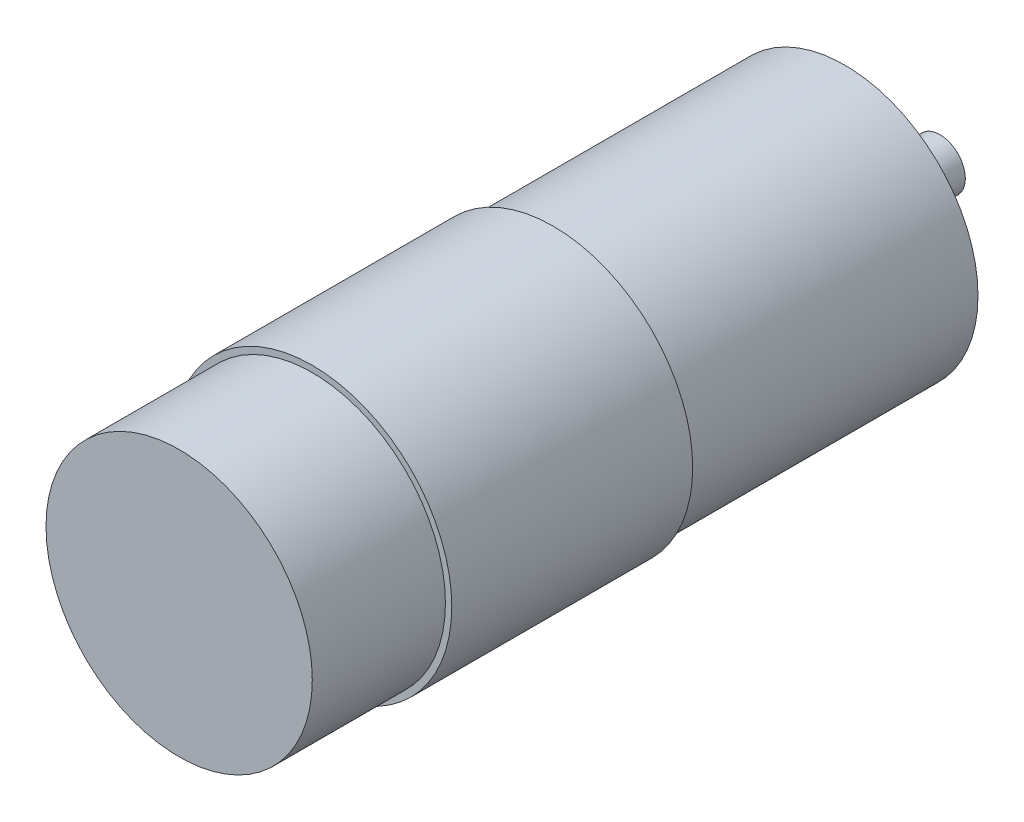
from build123d import *

# Parameters (mm, degrees)
SKETCH_1_R               = 21
SKETCH_1_R_2             = 4
SKETCH_1_R_3             = 12.5
EXTRUDE_1_DEPTH          = 105
EXTRUDE_START            = -46
SKETCH_3_R               = 22
EXTRUDE_3_DEPTH          = 38
SKETCH_1_4_R             = 12.5
SKETCH_1_4_R_2           = 4
EXTRUDE_4_DEPTH          = 2
EXTRUDE_START_2          = -2
SKETCH_1_5_R             = 4
EXTRUDE_5_DEPTH          = 13
SKETCH_4_R               = 1.5
CUT_EXTRUDE_1_DEPTH      = 6.5
PATTERN_CIRCULAR_1_COUNT = 4


with BuildPart() as part:
    # 스케치1 → 보스-돌출1 (new body)
    # profile 1 of 3: a face of its own
    with BuildSketch(Plane.XY):
        Circle(SKETCH_1_R)
        Circle(SKETCH_1_R_2, mode=Mode.SUBTRACT)
    # profile 2 of 3: a face of its own
    with BuildSketch(Plane.XY):
        Circle(SKETCH_1_R_3)
        Circle(SKETCH_1_R_2, mode=Mode.SUBTRACT)
    # profile 3 of 3: a face of its own
    with BuildSketch(Plane.XY):
        Circle(SKETCH_1_R_2)
    extrude(amount=EXTRUDE_1_DEPTH)

    # 스케치3 → 보스-돌출3 (add)
    with BuildSketch(Plane(origin=(0, 0, 0), x_dir=(-1, 0, 0), z_dir=(0, 0, -1)).offset(EXTRUDE_START)):
        Circle(SKETCH_3_R)
    extrude(amount=-EXTRUDE_3_DEPTH)

    # 스케치1<4> → 보스-돌출4 (add)
    # profile 1 of 2: a face of its own
    with BuildSketch(Plane.XY):
        Circle(SKETCH_1_4_R)
        Circle(SKETCH_1_4_R_2, mode=Mode.SUBTRACT)
    # profile 2 of 2: a face of its own
    with BuildSketch(Plane.XY):
        Circle(SKETCH_1_4_R_2)
    extrude(amount=-EXTRUDE_4_DEPTH)

    # 스케치1<5> → 보스-돌출5 (add)
    with BuildSketch(Plane.XY.offset(EXTRUDE_START_2)):
        Circle(SKETCH_1_5_R)
    extrude(amount=-EXTRUDE_5_DEPTH)

    # 스케치4 → 컷-돌출1 (cut)
    with BuildSketch(Plane(origin=(0, 0, 0), x_dir=(-1, 0, 0), z_dir=(0, 0, -1))):
        with Locations((0, -17.5)):
            Circle(SKETCH_4_R)
    cut_extrude_1 = extrude(amount=-CUT_EXTRUDE_1_DEPTH, mode=Mode.SUBTRACT)

    # 원형 패턴1: 컷-돌출1 ×4 about axis
    pattern_circular_1_axis = Axis((0, 0, 0), (0, 0, 1))
    for i in range(1, PATTERN_CIRCULAR_1_COUNT):
        add(cut_extrude_1.rotate(pattern_circular_1_axis, i * 360 / PATTERN_CIRCULAR_1_COUNT), mode=Mode.SUBTRACT)


solid = part.part
